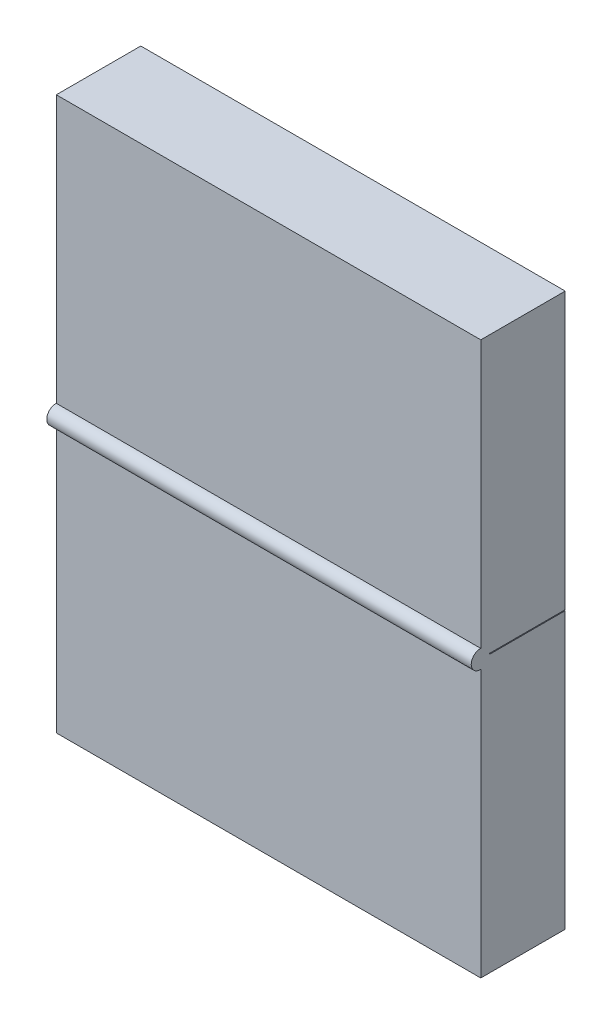
from build123d import *

# Parameters (mm, degrees)
BOSS_EXTRUDE1_DEPTH = 50


with BuildPart() as part:
    # Sketch2 → Boss-Extrude1 (new, symmetric)
    with BuildSketch(Plane(origin=(0, 0, 0), x_dir=(0, 0, -1), z_dir=(1, 0, 0))):
        with BuildLine():
            Line((0.1, 65.1), (0.1, 2.147673159))
            ThreePointArc((0.1, 2.147673159), (-2.15, 0), (0.1, -2.147673159))
            Line((0.1, -2.147673159), (0.1, -65.1))
            Line((0.1, -65.1), (20, -65.1))
            Line((20, -65.1), (20, -0.1))
            Line((20, -0.1), (2.147673159, -0.1))
            ThreePointArc((2.147673159, -0.1), (2.15, 0), (2.147673159, 0.1))
            Line((2.147673159, 0.1), (20, 0.1))
            Line((20, 0.1), (20, 65.1))
            Line((20, 65.1), (0.1, 65.1))
        make_face()
    extrude(amount=BOSS_EXTRUDE1_DEPTH, both=True)


solid = part.part
